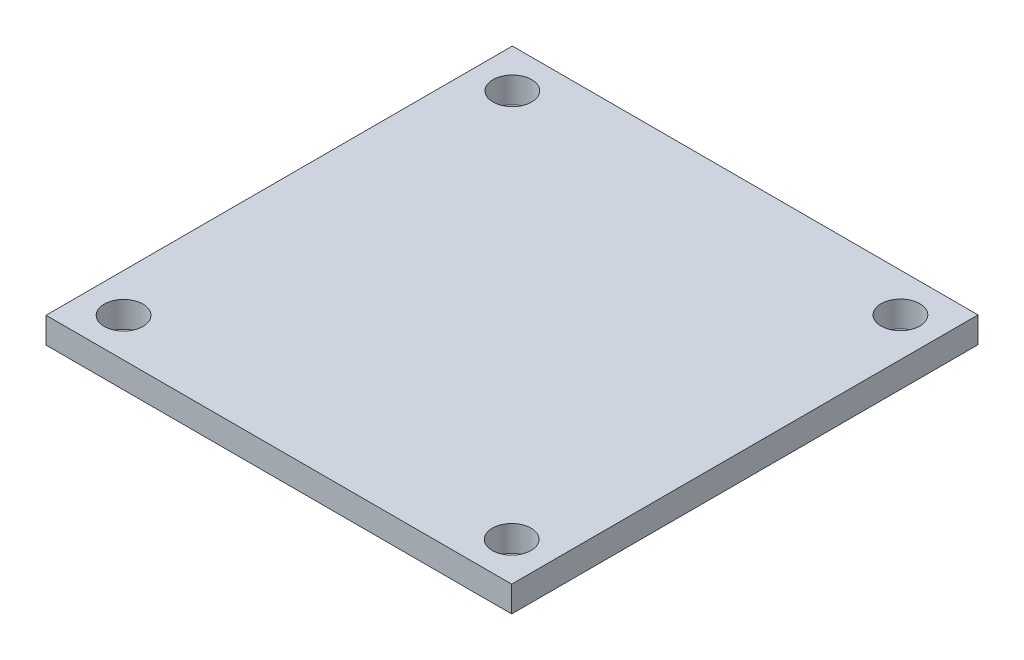
from build123d import *

# Parameters (mm, degrees)
SKETCH1_W           = 36.0172
SKETCH1_H           = 36.068
SKETCH1_R           = 1.5
BOSS_EXTRUDE1_DEPTH = 2


with BuildPart() as part:
    # Sketch1 → Boss-Extrude1 (new body)
    with BuildSketch(Plane(origin=(0, 0, 0), x_dir=(1, 0, 0), z_dir=(0, 1, 0))):
        Rectangle(SKETCH1_W, SKETCH1_H)
        with Locations(Location((-15.0086, 15.034, 0), (0, 0, 270))):
            Circle(SKETCH1_R, mode=Mode.SUBTRACT)
        with Locations(Location((15.0086, 15.034, 0), (0, 0, 90))):
            Circle(SKETCH1_R, mode=Mode.SUBTRACT)
        with Locations(Location((-15.0086, -15.034, 0), (0, 0, 90))):
            Circle(SKETCH1_R, mode=Mode.SUBTRACT)
        with Locations(Location((15.0086, -15.034, 0), (0, 0, 270))):
            Circle(SKETCH1_R, mode=Mode.SUBTRACT)
    extrude(amount=BOSS_EXTRUDE1_DEPTH)


solid = part.part
